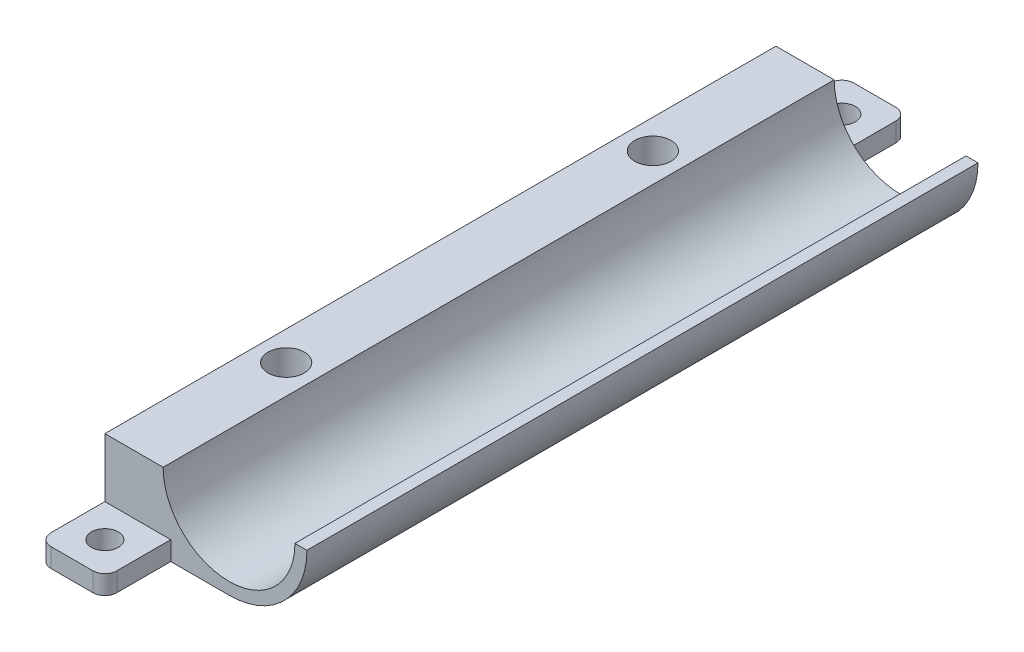
from build123d import *

# Parameters (mm, degrees)
BOSS_EXTRUDE1_DEPTH  = 112
SKETCH2_R            = 3.025
CUT_EXTRUDE1_DEPTH   = 8
SKETCH3_W            = 11
SKETCH3_H            = 11
BOSS_EXTRUDE2_DEPTH  = 3.175
FILLET1_R            = 2
M4_CLEARANCE_HOLE1_D = 4.5


with BuildPart() as part:
    # Sketch1 → Boss-Extrude1 (new body)
    with BuildSketch(Plane.XY):
        with BuildLine():
            ThreePointArc((0, -13), (-9.192388155, -9.192388155), (-13, 0))
            Line((-13, 0), (-20.724457785, 0))
            Line((-20.724457785, 0), (-20.724457785, -13))
            Line((-20.724457785, -13), (0, -13))
        make_face()
        with BuildLine():
            Line((-11, 0), (-13, 0))
            ThreePointArc((-13, 0), (-9.192388155, -9.192388155), (0, -13))
            ThreePointArc((0, -13), (9.192388155, -9.192388155), (13, 0))
            Line((13, 0), (11, 0))
            ThreePointArc((11, 0), (0, -11), (-11, 0))
        make_face()
    extrude(amount=BOSS_EXTRUDE1_DEPTH)

    # Sketch2 → Cut-Extrude1 (cut)
    with BuildSketch(Plane(origin=(0, 0, 0), x_dir=(1, 0, 0), z_dir=(0, 1, 0))):
        with Locations(Location((-15.862228893, -25.4, 0), (0, 0, 180))):
            Circle(SKETCH2_R)
        with Locations(Location((-15.862228893, -86.6, 0), (0, 0, 180))):
            Circle(SKETCH2_R)
    extrude(amount=-CUT_EXTRUDE1_DEPTH, mode=Mode.SUBTRACT)

    # Sketch3 → Boss-Extrude2 (add)
    with BuildSketch(Plane.XZ.offset(13)):
        with Locations((-15.224457785, 117.5)):
            Rectangle(SKETCH3_W, SKETCH3_H)
        with Locations((-15.224457785, -5.5)):
            Rectangle(SKETCH3_W, SKETCH3_H)
    extrude(amount=-BOSS_EXTRUDE2_DEPTH)

    # Fillet1
    fillet1_edges = [part.edges().sort_by_distance(p)[0] for p in [
        (-20.724457785, -11.4125, 123),
        (-9.724457785, -11.4125, 123),
        (-20.724457785, -11.4125, -11),
        (-9.724457785, -11.4125, -11),
    ]]
    fillet(fillet1_edges, radius=FILLET1_R)

    # M4 Clearance Hole1 (through all)
    with Locations(Plane(origin=(0, -13, 0), x_dir=(-1, 0, 0), z_dir=(0, -1, 0))):
        with Locations((15.224457785, 5.5), (15.224457785, -117.5)):
            Hole(M4_CLEARANCE_HOLE1_D / 2)


solid = part.part
